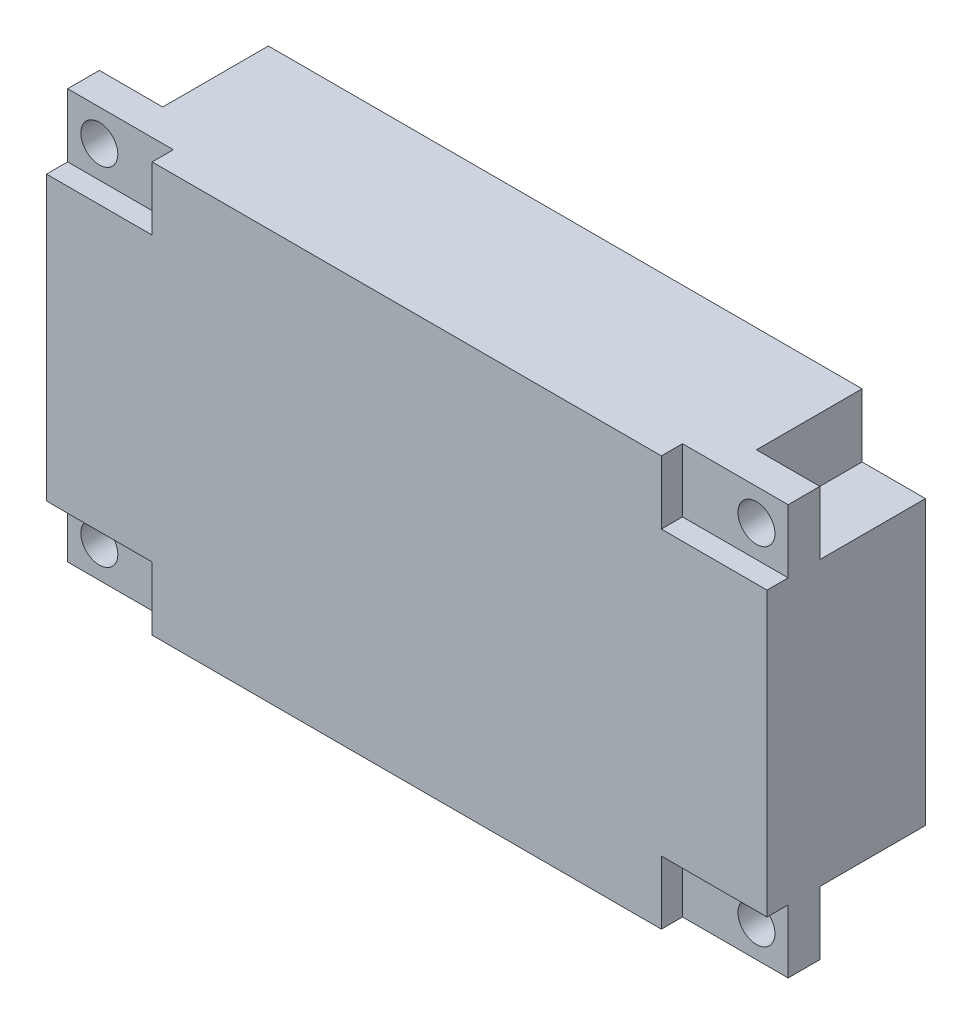
from build123d import *

# Parameters (mm, degrees)
ESQUISSE1_W             = 68.2
ESQUISSE1_H             = 38.8
BOSS_EXTRU_2_DEPTH      = 15
ESQUISSE3_W             = 10
ESQUISSE3_H             = 6
ENL_V_MAT_EXTRU_1_DEPTH = 2
ESQUISSE4_R             = 1.75
ENL_V_MAT_EXTRU_2_DEPTH = 80.885417943
ESQUISSE6_W             = 6
ESQUISSE6_H             = 6
ENL_V_MAT_EXTRU_3_DEPTH = 10


with BuildPart() as part:
    # Esquisse1 → Boss.-Extru.2 (new body)
    with BuildSketch(Plane.XY):
        with Locations((34.1, 19.4)):
            Rectangle(ESQUISSE1_W, ESQUISSE1_H)
    extrude(amount=BOSS_EXTRU_2_DEPTH)

    # Esquisse3 → Enlèv. mat.-Extru.1 (cut)
    with BuildSketch(Plane.XY.offset(15)):
        with Locations((5, 35.8)):
            Rectangle(ESQUISSE3_W, ESQUISSE3_H)
        with Locations((5, 3)):
            Rectangle(ESQUISSE3_W, ESQUISSE3_H)
        with Locations((63.2, 3)):
            Rectangle(ESQUISSE3_W, ESQUISSE3_H)
        with Locations((63.2, 35.8)):
            Rectangle(ESQUISSE3_W, ESQUISSE3_H)
    extrude(amount=-ENL_V_MAT_EXTRU_1_DEPTH, mode=Mode.SUBTRACT)

    # Esquisse4 → Enlèv. mat.-Extru.2 (cut, through all)
    with BuildSketch(Plane.XY.offset(15)):
        with Locations((3, 35.8)):
            Circle(ESQUISSE4_R)
        with Locations((3, 3)):
            Circle(ESQUISSE4_R)
        with Locations((65.2, 35.8)):
            Circle(ESQUISSE4_R)
        with Locations((65.2, 3)):
            Circle(ESQUISSE4_R)
    extrude(amount=-ENL_V_MAT_EXTRU_2_DEPTH, mode=Mode.SUBTRACT)

    # Esquisse6 → Enlèv. mat.-Extru.3 (cut)
    with BuildSketch(Plane(origin=(0, 0, 0), x_dir=(-1, 0, 0), z_dir=(0, 0, -1))):
        with Locations((-65.2, 35.8)):
            Rectangle(ESQUISSE6_W, ESQUISSE6_H)
        with Locations((-3, 35.8)):
            Rectangle(ESQUISSE6_W, ESQUISSE6_H)
        with Locations((-3, 3)):
            Rectangle(ESQUISSE6_W, ESQUISSE6_H)
        with Locations((-65.2, 3)):
            Rectangle(ESQUISSE6_W, ESQUISSE6_H)
    extrude(amount=-ENL_V_MAT_EXTRU_3_DEPTH, mode=Mode.SUBTRACT)


solid = part.part
